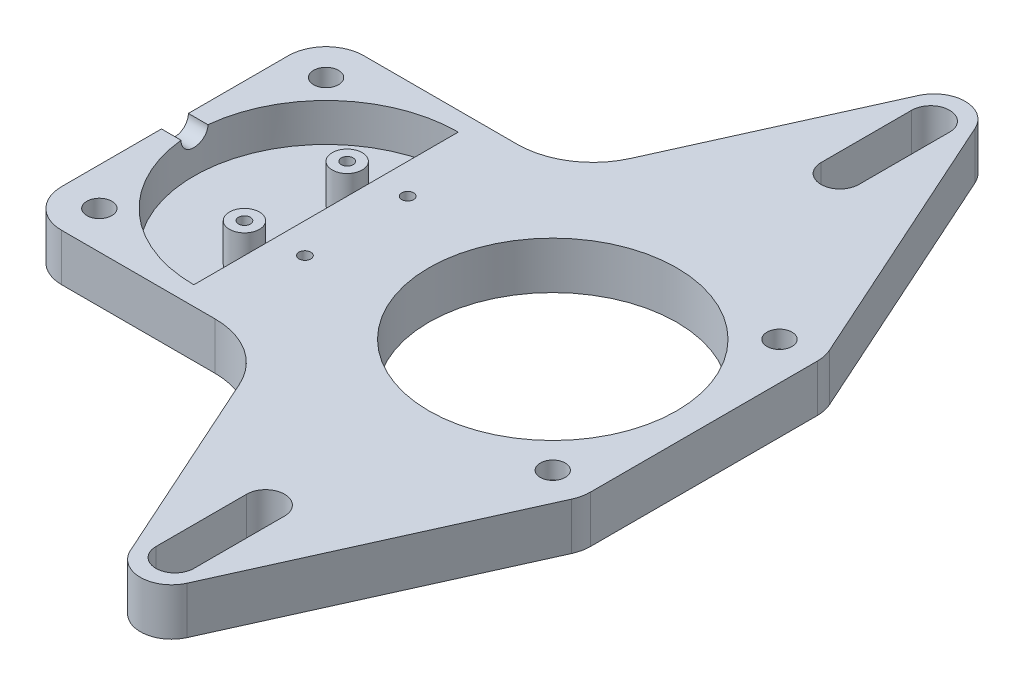
from build123d import *

# Parameters (mm, degrees)
SKETCH1_R               = 20.828
SKETCH1_R_2             = 2.1
BOSS_EXTRUDE1_DEPTH     = 7.9248
CUT_EXTRUDE1_DEPTH      = 6.4008
SKETCH3_R               = 2.52095
SKETCH3_R_2             = 0.99695
BOSS_EXTRUDE2_DEPTH     = 6.4008
SKETCH4_R               = 0.99695
CUT_EXTRUDE2_DEPTH      = 69.690466883
SKETCH5_R               = 20.828
SKETCH5_R_2             = 0.99695
BOSS_EXTRUDE3_DEPTH     = 6.4008
BOSS_EXTRUDE4_DEPTH     = 7.9248
CUT_EXTRUDE3_REACH      = 114.995
CUT_EXTRUDE3_END_RADIUS = 22.225
SKETCH7_R               = 2.2606
CUT_EXTRUDE4_DEPTH      = 5
FILLET1_R               = 12.7
CUT_EXTRUDE5_DEPTH      = 60.706


with BuildPart() as part:
    # Sketch1 → Boss-Extrude1 (new body)
    with BuildSketch(Plane(origin=(0, 0, 0), x_dir=(1, 0, 0), z_dir=(0, 1, 0))):
        with BuildLine():
            Line((-19.05, -25.4), (57.15, -25.4))
            ThreePointArc((57.15, -25.4), (61.640128061, -23.540128061), (63.5, -19.05))
            Line((63.5, -19.05), (63.5, 19.05))
            ThreePointArc((63.5, 19.05), (61.640128061, 23.540128061), (57.15, 25.4))
            Line((57.15, 25.4), (-19.05, 25.4))
            ThreePointArc((-19.05, 25.4), (-23.540128061, 23.540128061), (-25.4, 19.05))
            Line((-25.4, 19.05), (-25.4, -19.05))
            ThreePointArc((-25.4, -19.05), (-23.540128061, -23.540128061), (-19.05, -25.4))
        make_face()
        with Locations(Location((38.1, 0, 0), (0, 0, 270))):
            Circle(SKETCH1_R, mode=Mode.SUBTRACT)
        with Locations(Location((-19.05, 19.05, 0), (0, 0, 270))):
            Circle(SKETCH1_R_2, mode=Mode.SUBTRACT)
        with Locations(Location((-19.05, -19.05, 0), (0, 0, 270))):
            Circle(SKETCH1_R_2, mode=Mode.SUBTRACT)
        with Locations(Location((57.15, -19.05, 0), (0, 0, 270))):
            Circle(SKETCH1_R_2, mode=Mode.SUBTRACT)
        with Locations(Location((57.15, 19.05, 0), (0, 0, 270))):
            Circle(SKETCH1_R_2, mode=Mode.SUBTRACT)
    extrude(amount=BOSS_EXTRUDE1_DEPTH)

    # Sketch2 → Cut-Extrude1 (cut)
    with BuildSketch(Plane(origin=(0, 7.9248, 0), x_dir=(1, 0, 0), z_dir=(0, 1, 0))):
        with BuildLine():
            Line((0, 22.225), (38.1, 22.225))
            ThreePointArc((38.1, 22.225), (60.325, 0), (38.1, -22.225))
            Line((38.1, -22.225), (0, -22.225))
            ThreePointArc((0, -22.225), (-22.225, 0), (0, 22.225))
        make_face()
    extrude(amount=-CUT_EXTRUDE1_DEPTH, mode=Mode.SUBTRACT)

    # Sketch3 → Boss-Extrude2 (add)
    # profile 1 of 4: a face of its own
    with BuildSketch(Plane(origin=(0, 1.524, 0), x_dir=(1, 0, 0), z_dir=(0, 1, 0))):
        with Locations(Location((-5.08, 8.636, 0), (0, 0, 90))):
            Circle(SKETCH3_R)
        with Locations(Location((-5.08, 8.636, 0), (0, 0, 90))):
            Circle(SKETCH3_R_2, mode=Mode.SUBTRACT)
    # profile 2 of 4: a face of its own
    with BuildSketch(Plane(origin=(0, 1.524, 0), x_dir=(1, 0, 0), z_dir=(0, 1, 0))):
        with Locations(Location((5.08, 8.636, 0), (0, 0, 90))):
            Circle(SKETCH3_R)
        with Locations(Location((5.08, 8.636, 0), (0, 0, 90))):
            Circle(SKETCH3_R_2, mode=Mode.SUBTRACT)
    # profile 3 of 4: a face of its own
    with BuildSketch(Plane(origin=(0, 1.524, 0), x_dir=(1, 0, 0), z_dir=(0, 1, 0))):
        with Locations(Location((5.08, -8.636, 0), (0, 0, 90))):
            Circle(SKETCH3_R)
        with Locations(Location((5.08, -8.636, 0), (0, 0, 90))):
            Circle(SKETCH3_R_2, mode=Mode.SUBTRACT)
    # profile 4 of 4: a face of its own
    with BuildSketch(Plane(origin=(0, 1.524, 0), x_dir=(1, 0, 0), z_dir=(0, 1, 0))):
        with Locations(Location((-5.08, -8.636, 0), (0, 0, 90))):
            Circle(SKETCH3_R)
        with Locations(Location((-5.08, -8.636, 0), (0, 0, 90))):
            Circle(SKETCH3_R_2, mode=Mode.SUBTRACT)
    extrude(amount=BOSS_EXTRUDE2_DEPTH)

    # Sketch4 → Cut-Extrude2 (cut, through all)
    with BuildSketch(Plane(origin=(0, 1.524, 0), x_dir=(1, 0, 0), z_dir=(0, 1, 0))):
        with Locations(Location((5.08, -8.636, 0), (0, 0, 90))):
            Circle(SKETCH4_R)
        with Locations(Location((-5.08, -8.636, 0), (0, 0, 90))):
            Circle(SKETCH4_R)
        with Locations(Location((5.08, 8.636, 0), (0, 0, 90))):
            Circle(SKETCH4_R)
        with Locations(Location((-5.08, 8.636, 0), (0, 0, 90))):
            Circle(SKETCH4_R)
    extrude(amount=-CUT_EXTRUDE2_DEPTH, mode=Mode.SUBTRACT)

    # Sketch5 → Boss-Extrude3 (add)
    with BuildSketch(Plane(origin=(0, 1.524, 0), x_dir=(1, 0, 0), z_dir=(0, 1, 0))):
        with BuildLine():
            Line((0, 22.225), (0, -22.225))
            Line((0, -22.225), (38.1, -22.225))
            ThreePointArc((38.1, -22.225), (60.325, 0), (38.1, 22.225))
            Line((38.1, 22.225), (0, 22.225))
        make_face()
        with Locations(Location((38.1, 0, 0), (0, 0, 90))):
            Circle(SKETCH5_R, mode=Mode.SUBTRACT)
        with Locations(Location((5.08, -8.636, 0), (0, 0, 90))):
            Circle(SKETCH5_R_2, mode=Mode.SUBTRACT)
        with Locations(Location((5.08, 8.636, 0), (0, 0, 90))):
            Circle(SKETCH5_R_2, mode=Mode.SUBTRACT)
    extrude(amount=BOSS_EXTRUDE3_DEPTH)

    # Sketch6 → Boss-Extrude4 (add)
    with BuildSketch(Plane.XZ):
        with BuildLine():
            Line((42.8625, 66.217346987), (62.939460474, 21.658571912))
            ThreePointArc((62.939460474, 21.658571912), (60.596597479, 24.383241587), (57.15, 25.4))
            Line((57.15, 25.4), (14.945483896, 25.4))
            Line((14.945483896, 25.4), (33.3375, 66.217346987))
            ThreePointArc((33.3375, 66.217346987), (35.264775446, 68.45870253), (38.1, 69.295103774))
            ThreePointArc((38.1, 69.295103774), (40.935224554, 68.45870253), (42.8625, 66.217346987))
        make_face()
        with BuildLine():
            Line((57.15, -25.4), (14.945483896, -25.4))
            Line((14.945483896, -25.4), (33.3375, -66.217346987))
            ThreePointArc((33.3375, -66.217346987), (35.264775446, -68.45870253), (38.1, -69.295103774))
            ThreePointArc((38.1, -69.295103774), (40.935224554, -68.45870253), (42.8625, -66.217346987))
            Line((42.8625, -66.217346987), (62.939460474, -21.658571912))
            ThreePointArc((62.939460474, -21.658571912), (60.596597479, -24.383241587), (57.15, -25.4))
        make_face()
    extrude(amount=-BOSS_EXTRUDE4_DEPTH)

    # Cut-Extrude3: up to this cylinder (the profile starts outside it)
    cut_extrude3_end = Plane(origin=(0, 7.9248, 0), z_dir=(0, 1, 0)) * Cylinder(CUT_EXTRUDE3_END_RADIUS, 275.44, mode=Mode.PRIVATE)
    # Sketch7 → Cut-Extrude3 (cut, up to the surface)
    with BuildSketch(Plane.ZY.offset(25.4), mode=Mode.PRIVATE) as cut_extrude3_sk1:
        with Locations((0, 7.9248)):
            Circle(SKETCH7_R)
    cut_extrude3_tool1 = extrude(cut_extrude3_sk1.sketch, amount=-CUT_EXTRUDE3_REACH, mode=Mode.PRIVATE) - cut_extrude3_end
    add(cut_extrude3_tool1.solids().sort_by_distance((-25.4, 7.9248, 0))[0], mode=Mode.SUBTRACT)

    # Sketch8 → Cut-Extrude4 (cut)
    with BuildSketch(Plane.XZ):
        Polygon((-17.000406544, 22.6), (-21.099593456, 22.6), (-23.149186911, 19.05), (-21.099593456, 15.5), (-17.000406544, 15.5), (-14.950813089, 19.05), align=None)
        Polygon((-17.000406544, -15.5), (-21.099593456, -15.5), (-23.149186911, -19.05), (-21.099593456, -22.6), (-17.000406544, -22.6), (-14.950813089, -19.05), align=None)
        Polygon((59.199593456, -15.5), (55.100406544, -15.5), (53.050813089, -19.05), (55.100406544, -22.6), (59.199593456, -22.6), (61.249186911, -19.05), align=None)
        Polygon((59.199593456, 22.6), (55.100406544, 22.6), (53.050813089, 19.05), (55.100406544, 15.5), (59.199593456, 15.5), (61.249186911, 19.05), align=None)
    extrude(amount=-CUT_EXTRUDE4_DEPTH, mode=Mode.SUBTRACT)

    # Fillet1
    fillet1_edges = [part.edges().sort_by_distance(p)[0] for p in [
        (14.945483896, 3.9624, 25.4),
        (14.945483896, 3.9624, -25.4),
    ]]
    fillet(fillet1_edges, radius=FILLET1_R)

    # Sketch9 → Cut-Extrude5 (cut)
    with BuildSketch(Plane(origin=(0, 7.9248, 0), x_dir=(1, 0, 0), z_dir=(0, 1, 0))):
        with BuildLine():
            Line((34.9123, -63.5), (34.9123, -48.26))
            ThreePointArc((34.9123, -48.26), (38.1, -45.0723), (41.2877, -48.26))
            Line((41.2877, -48.26), (41.2877, -63.5))
            ThreePointArc((41.2877, -63.5), (38.1, -66.6877), (34.9123, -63.5))
        make_face()
        with BuildLine():
            Line((41.2877, 63.5), (41.2877, 48.26))
            ThreePointArc((41.2877, 48.26), (38.1, 45.0723), (34.9123, 48.26))
            Line((34.9123, 48.26), (34.9123, 63.5))
            ThreePointArc((34.9123, 63.5), (38.1, 66.6877), (41.2877, 63.5))
        make_face()
    extrude(amount=-CUT_EXTRUDE5_DEPTH, mode=Mode.SUBTRACT)


solid = part.part
